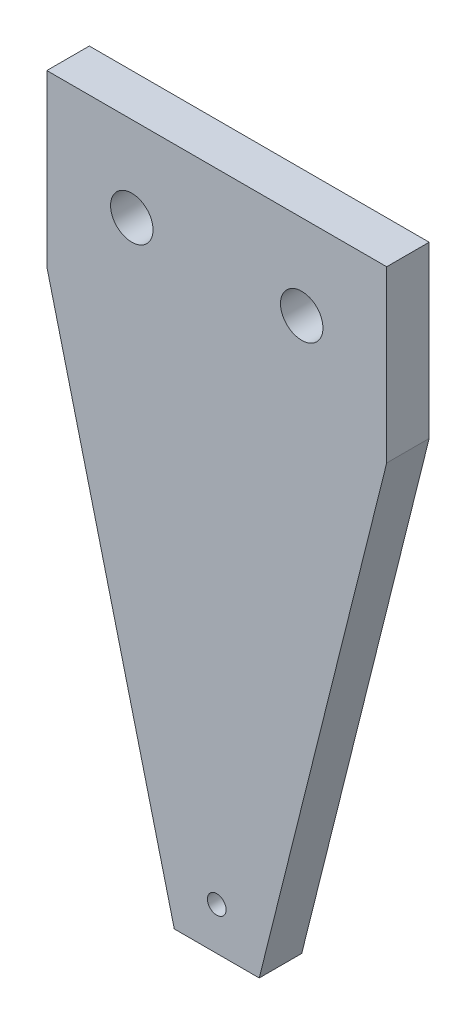
from build123d import *

# Parameters (mm, degrees)
CROQUIS1_W              = 40
CROQUIS1_H              = 20
CROQUIS1_R              = 2.5
SALIENTE_EXTRUIR1_DEPTH = 5
CROQUIS2_W              = 10
CROQUIS2_H              = 10
CROQUIS2_R              = 1.1
SALIENTE_EXTRUIR2_DEPTH = 5


with BuildPart() as part:
    # Croquis1 → Saliente-Extruir1 (new body)
    with BuildSketch(Plane.XY):
        Rectangle(CROQUIS1_W, CROQUIS1_H)
        with Locations((-10, 0)):
            Circle(CROQUIS1_R, mode=Mode.SUBTRACT)
        with Locations(Location((10, 0, 0), (0, 0, 180))):
            Circle(CROQUIS1_R, mode=Mode.SUBTRACT)
    extrude(amount=SALIENTE_EXTRUIR1_DEPTH)

    # Croquis2 → Saliente-Extruir2 (add)
    # profile 1 of 2: a face of its own
    with BuildSketch(Plane.XY.offset(5)):
        Polygon((5, -60), (5, -70), (20, -10), (-20, -10), (-5, -70), (-5, -60), align=None)
    # profile 2 of 2: a face of its own
    with BuildSketch(Plane.XY.offset(5)):
        with Locations((0, -65)):
            Rectangle(CROQUIS2_W, CROQUIS2_H)
        with Locations((0, -65)):
            Circle(CROQUIS2_R, mode=Mode.SUBTRACT)
    extrude(amount=-SALIENTE_EXTRUIR2_DEPTH)


solid = part.part
